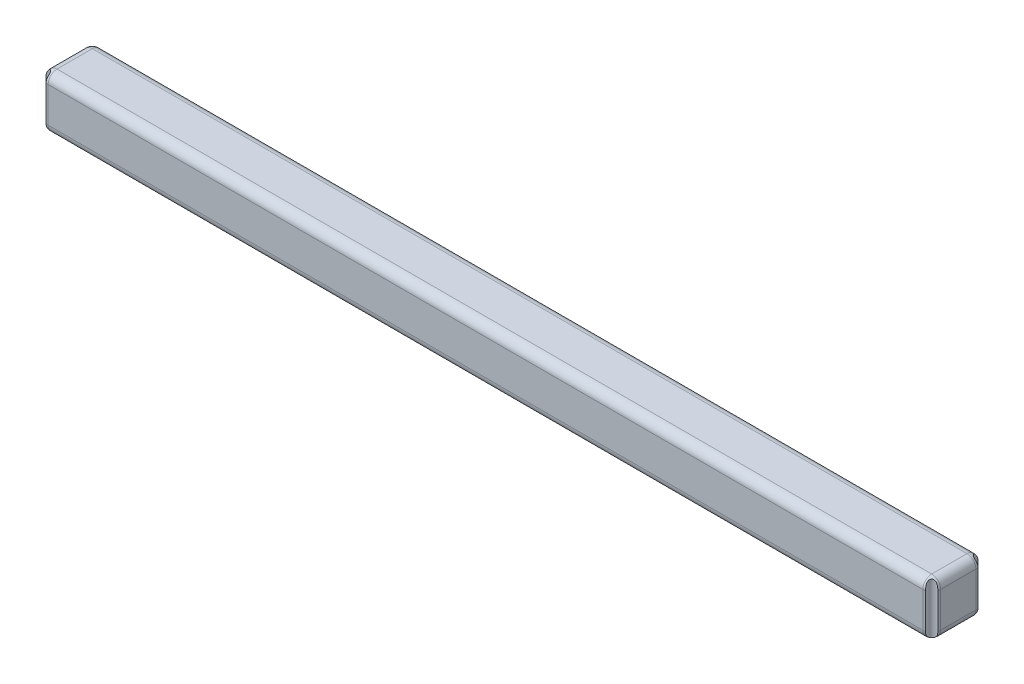
from build123d import *

# Parameters (mm, degrees)
SKETCH1_W           = 100
SKETCH1_H           = 5.95
BOSS_EXTRUDE1_DEPTH = 5.95
FILLET1_R           = 1
SKETCH2_R           = 0.5
CUT_EXTRUDE1_DEPTH  = 10


with BuildPart() as part:
    # Sketch1 → Boss-Extrude1 (new body)
    with BuildSketch(Plane.XY):
        with Locations((50, 2.975)):
            Rectangle(SKETCH1_W, SKETCH1_H)
    extrude(amount=BOSS_EXTRUDE1_DEPTH)

    # Fillet1
    fillet1_edges = [part.edges().sort_by_distance(p)[0] for p in [
        (100, 2.975, 5.95),
        (50, 5.95, 5.95),
        (0, 2.975, 5.95),
        (50, 5.95, 0),
        (100, 2.975, 0),
        (50, 0, 0),
        (0, 2.975, 0),
        (0, 5.95, 2.975),
        (100, 5.95, 2.975),
        (100, 0, 2.975),
        (0, 0, 2.975),
        (50, 0, 5.95),
    ]]
    fillet(fillet1_edges, radius=FILLET1_R)

    # Sketch2 → Cut-Extrude1 (cut)
    with BuildSketch(Plane(origin=(0, 5.95, 0), x_dir=(1, 0, 0), z_dir=(0, 1, 0))):
        with Locations((99.707106781, -0.292893219)):
            Circle(SKETCH2_R)
        with Locations((99.707106781, -5.657106781)):
            Circle(SKETCH2_R)
        with Locations((0.292893219, -0.292893219)):
            Circle(SKETCH2_R)
        with Locations((0.292893219, -5.657106781)):
            Circle(SKETCH2_R)
    extrude(amount=-CUT_EXTRUDE1_DEPTH, mode=Mode.SUBTRACT)


solid = part.part
